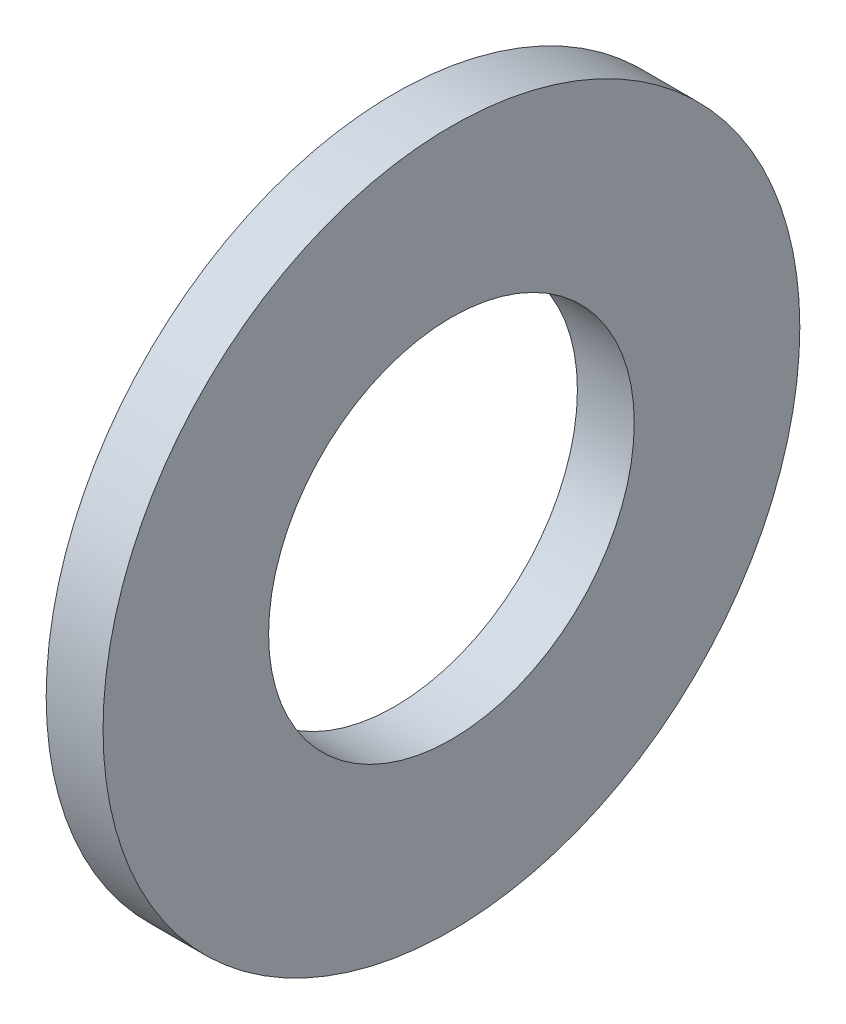
from build123d import *

# Parameters (mm, degrees)
SKETCH1_R           = 7.9375
SKETCH1_R_2         = 4.1656
BOSS_EXTRUDE1_DEPTH = 1.2954


with BuildPart() as part:
    # Sketch1 → Boss-Extrude1 (new body)
    with BuildSketch(Plane(origin=(0, 0, 0), x_dir=(0, 0, -1), z_dir=(1, 0, 0))):
        Circle(SKETCH1_R)
        Circle(SKETCH1_R_2, mode=Mode.SUBTRACT)
    extrude(amount=BOSS_EXTRUDE1_DEPTH)


solid = part.part
